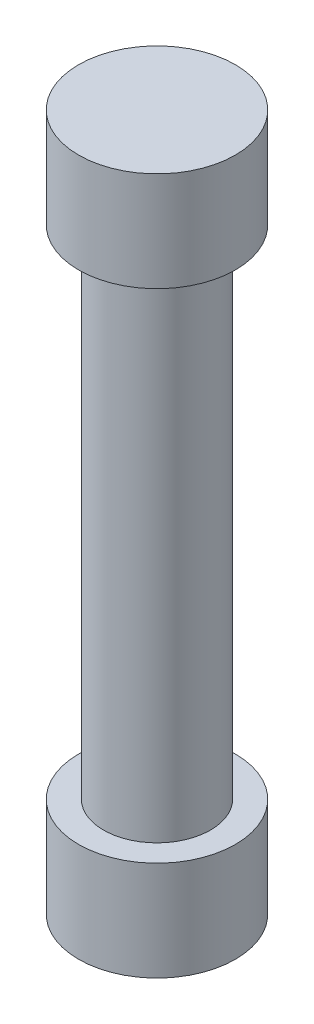
from build123d import *


with BuildPart() as part:
    # Sketch1 → Revolve1 (revolve)
    with BuildSketch(Plane.XY, mode=Mode.PRIVATE) as revolve1_sk:
        Polygon((0, 0), (0, 28), (-3.15, 28), (-3.15, 24), (-2.15, 24), (-2.15, 4), (-3.15, 4), (-3.15, 0), align=None)
    revolve(revolve1_sk.sketch.rotate(Axis((0, 0, 0), (0, 1, 0)), 270), axis=Axis((0, 0, 0), (0, 1, 0)))


solid = part.part
